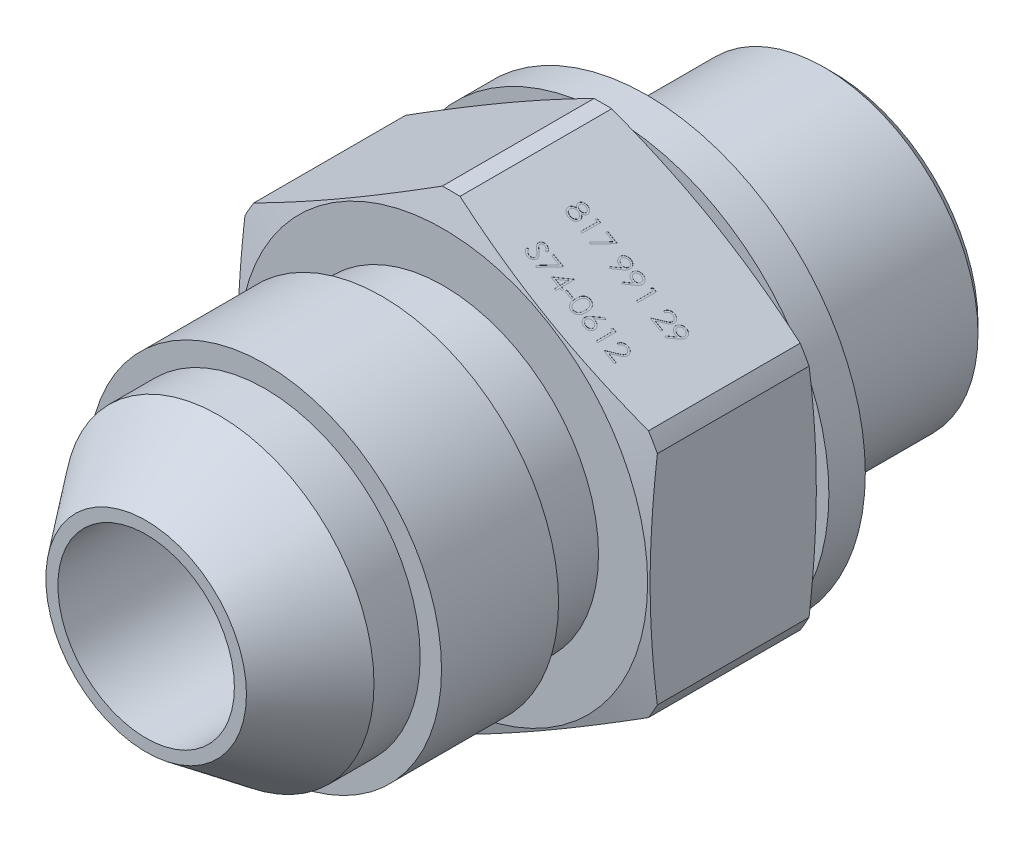
from build123d import *

# Parameters (mm, degrees)
SKETCH2_OUTSIDE_W  = 37.354
SKETCH2_OUTSIDE_H  = 37.354
EXTRUDE2_DEPTH     = 9
SKETCH3_R          = 11.75
SKETCH3_R_2        = 9.9
EXTRUDE3_DEPTH     = 1.96
SKETCH5_W          = 0.384615385
SKETCH5_H          = 0.102564102
CUT_EXTRUDE1_DEPTH = 0.01
SKETCH6_R          = 1.2


with BuildPart() as part:
    # Sketch1 → Revolve1 (revolve)
    with BuildSketch(Plane(origin=(0, 0, 0), x_dir=(0, 0, -1), z_dir=(1, 0, 0)), mode=Mode.PRIVATE) as revolve1_sk:
        Polygon((0, 5.4), (3.914782224, 8.35), (6.4, 8.35), (6.4, 9.5), (12.7, 9.5), (12.7, 8.35), (16, 8.35), (16, 10.99402544), (16.416922127, 12.55), (24.583077873, 12.55), (25, 10.99402544), (25, 8.275), (36.5, 8.275), (37, 7.775), (37, 6.8), (33.449295844, 4.75), (0, 4.75), align=None)
    revolve(revolve1_sk.sketch.rotate(Axis((0, 0, 0), (0, 0, -1)), 90), axis=Axis((0, 0, 0), (0, 0, -1)))

    # Sketch2 outside → Extrude2 (cut)
    with BuildSketch(Plane.XY.offset(-16)):
        Rectangle(SKETCH2_OUTSIDE_W, SKETCH2_OUTSIDE_H)
        Polygon((0, 12.817175976), (-11.1, 6.408587988), (-11.1, -6.408587988), (0, -12.817175976), (11.1, -6.408587988), (11.1, 6.408587988), align=None, mode=Mode.SUBTRACT)
    extrude(amount=-EXTRUDE2_DEPTH, mode=Mode.SUBTRACT)

    # Sketch3 → Extrude3 (add)
    with BuildSketch(Plane(origin=(0, 0, -25), x_dir=(-1, 0, 0), z_dir=(0, 0, -1))):
        Circle(SKETCH3_R)
        Circle(SKETCH3_R_2, mode=Mode.SUBTRACT)
    extrude(amount=EXTRUDE3_DEPTH)

    # Sketch5 → Cut-Extrude1 (cut)
    # profile 1 of 16: a face of its own
    with BuildSketch(Plane(origin=(5.55, 9.612881982, 0), x_dir=(0.8660254037844386, -0.5000000000000001, 0), z_dir=(0.5000000000000001, 0.8660254037844386, 0))):
        with BuildLine():
            add(Edge.make_bspline(
                [(-2.871822735, 20.366585469), (-2.863637436, 20.362317482), (-2.847673369, 20.353993481), (-2.824937024, 20.340590387), (-2.804158452, 20.326464397), (-2.784761149, 20.312282723), (-2.767085906, 20.297502251), (-2.751330359, 20.282064207), (-2.737105325, 20.266353937), (-2.724697672, 20.250105411), (-2.71378429, 20.233361797), (-2.704352252, 20.216079147), (-2.696290194, 20.198295338), (-2.689900783, 20.179816243), (-2.684637414, 20.160913311), (-2.681015812, 20.14134246), (-2.679068121, 20.121232648), (-2.678699889, 20.107641705), (-2.67851344, 20.100760149)],
                knots=[0, 0, 0, 0, 1.272397273, 2.481599622, 3.635517121, 4.734568067, 5.792894095, 6.808321871, 7.773003508, 8.711915296, 9.623354172, 10.525449501, 11.423591555, 12.311487226, 13.218079475, 14.126165749, 15.051214107, 16, 16, 16, 16], degree=3))
            add(Edge.make_bspline(
                [(-2.67851344, 20.100760149), (-2.678733846, 20.091132225), (-2.679170112, 20.072074952), (-2.682970108, 20.043947491), (-2.68865953, 20.016629839), (-2.696967962, 19.990127985), (-2.707743217, 19.964588164), (-2.721022313, 19.939988514), (-2.736054085, 19.915925854), (-2.748126154, 19.901120311), (-2.754234594, 19.893628738)],
                knots=[0, 0, 0, 0, 1.025265484, 2.029385089, 3.018602448, 3.995076438, 4.983346944, 5.966715145, 6.97116228, 8, 8, 8, 8], degree=3))
            add(Edge.make_bspline(
                [(-2.754234594, 19.893628738), (-2.762187873, 19.88488766), (-2.777996148, 19.867513519), (-2.805076985, 19.844956145), (-2.834797523, 19.825999175), (-2.867042761, 19.810550062), (-2.901726504, 19.798525531), (-2.938841363, 19.789884812), (-2.978459692, 19.784935546), (-3.005689827, 19.784220121), (-3.019659274, 19.783853097)],
                knots=[0, 0, 0, 0, 0.954267603, 1.896743057, 2.838368354, 3.796610408, 4.779680527, 5.799409237, 6.871065594, 8, 8, 8, 8], degree=3))
            add(Edge.make_bspline(
                [(-3.019659274, 19.783853097), (-3.03309167, 19.784182377), (-3.05922975, 19.784823121), (-3.097274858, 19.789164387), (-3.132738592, 19.796772349), (-3.165827155, 19.807185095), (-3.196341067, 19.820730874), (-3.224193382, 19.837590419), (-3.249785945, 19.857085117), (-3.27234208, 19.879774854), (-3.29236735, 19.904077103), (-3.309958222, 19.929148992), (-3.324579388, 19.954992808), (-3.336958558, 19.981223199), (-3.346435136, 20.008207814), (-3.352998624, 20.035807818), (-3.357167, 20.063975001), (-3.35772161, 20.082984045), (-3.35800062, 20.092547007)],
                knots=[0, 0, 0, 0, 1.256902934, 2.445805442, 3.576955095, 4.645999104, 5.686449165, 6.692658513, 7.68621702, 8.689161843, 9.678783111, 10.630372946, 11.551080876, 12.453998257, 13.34127905, 14.221779781, 15.105423033, 16, 16, 16, 16], degree=3))
            add(Edge.make_bspline(
                [(-3.35800062, 20.092547007), (-3.357835511, 20.09956392), (-3.357509198, 20.113431814), (-3.355250669, 20.133920194), (-3.351619681, 20.153861947), (-3.346688407, 20.173330731), (-3.340005257, 20.192184808), (-3.331936076, 20.210513515), (-3.322526947, 20.228337543), (-3.311646614, 20.245754367), (-3.298988893, 20.262519942), (-3.284656421, 20.278918797), (-3.268362744, 20.294696473), (-3.250289128, 20.310045738), (-3.230642116, 20.325238873), (-3.208911393, 20.339454796), (-3.185673031, 20.353699928), (-3.169157201, 20.362216593), (-3.160684915, 20.366585469)],
                knots=[0, 0, 0, 0, 0.941657376, 1.861047343, 2.762797495, 3.66048619, 4.553285746, 5.444104102, 6.34607688, 7.256116206, 8.197091036, 9.162375105, 10.176350973, 11.237807142, 12.343728897, 13.50695164, 14.721116704, 16, 16, 16, 16], degree=3))
            add(Edge.make_bspline(
                [(-3.160684915, 20.366585469), (-3.17228245, 20.372909689), (-3.194738525, 20.385155148), (-3.224472651, 20.407654235), (-3.25001283, 20.432022182), (-3.270657035, 20.458773552), (-3.286906243, 20.487072659), (-3.298054415, 20.516742446), (-3.305596268, 20.547232764), (-3.306343361, 20.568063106), (-3.306718569, 20.578524572)],
                knots=[0, 0, 0, 0, 1.166880483, 2.259407225, 3.286803203, 4.280235371, 5.237608625, 6.161067461, 7.076446754, 8, 8, 8, 8], degree=3))
            add(Edge.make_bspline(
                [(-3.306718569, 20.578524572), (-3.306251304, 20.589181017), (-3.305312022, 20.61060233), (-3.297716788, 20.642489794), (-3.285339626, 20.673808813), (-3.268505055, 20.704407588), (-3.247537279, 20.733250506), (-3.222381123, 20.759119348), (-3.193637324, 20.781779772), (-3.161449362, 20.800801535), (-3.126810438, 20.816282581), (-3.090263088, 20.82696213), (-3.05244409, 20.833943878), (-3.026701885, 20.83473435), (-3.013649658, 20.835135149)],
                knots=[0, 0, 0, 0, 0.888701115, 1.786444228, 2.72001202, 3.692817113, 4.693886446, 5.687152267, 6.695133018, 7.739871481, 8.800368666, 9.853104506, 10.91144658, 12, 12, 12, 12], degree=3))
            add(Edge.make_bspline(
                [(-3.013649658, 20.835135149), (-3.000934283, 20.834721908), (-2.97586101, 20.833907044), (-2.939005402, 20.827110793), (-2.903741152, 20.815759501), (-2.870189866, 20.800360295), (-2.83895219, 20.781392597), (-2.81135153, 20.758420919), (-2.786970792, 20.73266619), (-2.766803823, 20.703832018), (-2.750185854, 20.67335082), (-2.738614168, 20.641458671), (-2.731199318, 20.608844654), (-2.730264071, 20.586776653), (-2.729795492, 20.575720084)],
                knots=[0, 0, 0, 0, 1.072916533, 2.115669174, 3.151510826, 4.193348718, 5.225979165, 6.227137561, 7.216255879, 8.211077061, 9.189680878, 10.138522389, 11.067357538, 12, 12, 12, 12], degree=3))
            add(Edge.make_bspline(
                [(-2.729795492, 20.575720084), (-2.730205366, 20.564869609), (-2.731010336, 20.543559892), (-2.737781748, 20.512495172), (-2.749185551, 20.483403161), (-2.764755312, 20.455953746), (-2.785048309, 20.430644747), (-2.809793661, 20.407154327), (-2.838794083, 20.385289519), (-2.860582908, 20.372950557), (-2.871822735, 20.366585469)],
                knots=[0, 0, 0, 0, 0.975232327, 1.915300861, 2.843280834, 3.77672583, 4.742871857, 5.749627742, 6.839139064, 8, 8, 8, 8], degree=3))
        make_face()
        with BuildLine():
            add(Edge.make_bspline(
                [(-3.018657671, 20.732571046), (-3.025672187, 20.73238492), (-3.039395647, 20.732020776), (-3.059518125, 20.730118309), (-3.078653087, 20.72641739), (-3.097000459, 20.721492044), (-3.114308691, 20.714838333), (-3.130812849, 20.707011187), (-3.146232046, 20.697495168), (-3.160752418, 20.68682054), (-3.173824068, 20.67507971), (-3.185425369, 20.662847219), (-3.195061973, 20.649882821), (-3.203245147, 20.636509004), (-3.209182723, 20.62232884), (-3.213629667, 20.607777075), (-3.216635779, 20.592669822), (-3.216861033, 20.582345105), (-3.216974979, 20.577122328)],
                knots=[0, 0, 0, 0, 1.203892937, 2.355340988, 3.463153438, 4.544400666, 5.610487187, 6.640501085, 7.674077295, 8.714426146, 9.728707835, 10.68524104, 11.601827946, 12.495867327, 13.368432065, 14.231010473, 15.105153427, 16, 16, 16, 16], degree=3))
            add(Edge.make_bspline(
                [(-3.216974979, 20.577122328), (-3.216778588, 20.571899325), (-3.216390492, 20.561577922), (-3.213389027, 20.546336246), (-3.20891564, 20.531358635), (-3.201872594, 20.517001232), (-3.193425063, 20.502765986), (-3.182998927, 20.489008676), (-3.17057349, 20.475681423), (-3.15656565, 20.462897583), (-3.141305211, 20.450926508), (-3.125138341, 20.44053417), (-3.108267944, 20.43183871), (-3.090867353, 20.424601737), (-3.072759225, 20.418976041), (-3.054054518, 20.414984999), (-3.034750089, 20.412504429), (-3.021669923, 20.412208137), (-3.015051902, 20.412058225)],
                knots=[0, 0, 0, 0, 0.873023192, 1.725219244, 2.590779336, 3.480155217, 4.391973325, 5.357036234, 6.360879153, 7.436073238, 8.526419356, 9.601555421, 10.645666583, 11.697338044, 12.750135903, 13.812665442, 14.89329948, 16, 16, 16, 16], degree=3))
            add(Edge.make_bspline(
                [(-3.015051902, 20.412058225), (-3.006551872, 20.412307616), (-2.989635767, 20.412803934), (-2.964698815, 20.417418555), (-2.940452345, 20.424677389), (-2.917155516, 20.434608808), (-2.895411348, 20.447073911), (-2.876028472, 20.46199763), (-2.859172217, 20.479035372), (-2.845017757, 20.497921897), (-2.834043515, 20.51802235), (-2.825500141, 20.538193863), (-2.820511222, 20.558651643), (-2.819860489, 20.57235649), (-2.819539081, 20.579125533)],
                knots=[0, 0, 0, 0, 1.076279235, 2.141928126, 3.20205304, 4.278698113, 5.344010996, 6.36967002, 7.368914609, 8.37248503, 9.349703398, 10.264243087, 11.142681841, 12, 12, 12, 12], degree=3))
            add(Edge.make_bspline(
                [(-2.819539081, 20.579125533), (-2.819691052, 20.583876401), (-2.819992692, 20.593306191), (-2.822478422, 20.607231439), (-2.826585803, 20.620839891), (-2.832146683, 20.634243968), (-2.839463768, 20.647255606), (-2.84813925, 20.660079346), (-2.858677679, 20.672426707), (-2.870505231, 20.684585435), (-2.883918205, 20.695838013), (-2.898890751, 20.705733644), (-2.915346109, 20.714137175), (-2.933284666, 20.720962533), (-2.952640358, 20.726088919), (-2.973324037, 20.729927876), (-2.995508164, 20.732091622), (-3.010773808, 20.732407772), (-3.018657671, 20.732571046)],
                knots=[0, 0, 0, 0, 0.814439003, 1.616544685, 2.417341072, 3.248991801, 4.09997495, 4.973547432, 5.9003056, 6.880240646, 7.880314356, 8.896779544, 9.951930927, 11.043077905, 12.18215768, 13.381699519, 14.647792085, 16, 16, 16, 16], degree=3))
        make_face(mode=Mode.SUBTRACT)
        with BuildLine():
            add(Edge.make_bspline(
                [(-3.012848376, 20.309494123), (-3.021741458, 20.30933594), (-3.039187514, 20.309025623), (-3.064746636, 20.30557148), (-3.089276112, 20.300763082), (-3.112693237, 20.293468556), (-3.134988122, 20.283983845), (-3.156281459, 20.272573976), (-3.176410354, 20.259086707), (-3.195096847, 20.243693388), (-3.212160655, 20.227104973), (-3.227131598, 20.209544363), (-3.239845175, 20.191337925), (-3.250083247, 20.172254431), (-3.258486599, 20.15269797), (-3.26400485, 20.132181515), (-3.267542482, 20.111099482), (-3.268017519, 20.096768026), (-3.26825703, 20.0895422)],
                knots=[0, 0, 0, 0, 1.140299081, 2.23698856, 3.303958914, 4.344563908, 5.37730929, 6.408454204, 7.439741482, 8.480804886, 9.510774543, 10.48932336, 11.43758569, 12.353841022, 13.263987381, 14.161954604, 15.073269652, 16, 16, 16, 16], degree=3))
            add(Edge.make_bspline(
                [(-3.26825703, 20.0895422), (-3.267867528, 20.080561941), (-3.267094764, 20.062745317), (-3.260964295, 20.036413011), (-3.251125571, 20.010921281), (-3.237404081, 19.986477866), (-3.220413346, 19.963634978), (-3.199520069, 19.9437239), (-3.176022687, 19.926032049), (-3.149126157, 19.911723325), (-3.119746595, 19.900296223), (-3.087891816, 19.892423091), (-3.054018982, 19.887211248), (-3.030630527, 19.886686054), (-3.018657671, 19.8864172)],
                knots=[0, 0, 0, 0, 0.898778495, 1.783155532, 2.693654817, 3.627872908, 4.583023416, 5.533784346, 6.509005473, 7.520592997, 8.575161974, 9.658835044, 10.801527049, 12, 12, 12, 12], degree=3))
            add(Edge.make_bspline(
                [(-3.018657671, 19.8864172), (-3.009300423, 19.886596859), (-2.991069503, 19.886946894), (-2.964473518, 19.890036692), (-2.939375076, 19.894936585), (-2.915822847, 19.902063312), (-2.893553179, 19.910763306), (-2.872943649, 19.921955329), (-2.85346407, 19.934684564), (-2.836074321, 19.949786894), (-2.820236261, 19.965923893), (-2.806426749, 19.983006762), (-2.794438877, 20.000571229), (-2.785030033, 20.019014224), (-2.777508246, 20.037981914), (-2.772101516, 20.057649203), (-2.768765454, 20.078076413), (-2.768428056, 20.09193329), (-2.76825703, 20.098957264)],
                knots=[0, 0, 0, 0, 1.224942928, 2.386581632, 3.501229538, 4.569074225, 5.605009692, 6.626002462, 7.634866581, 8.645888296, 9.63523824, 10.59253846, 11.518950513, 12.414518923, 13.29783783, 14.186679152, 15.080837789, 16, 16, 16, 16], degree=3))
            add(Edge.make_bspline(
                [(-2.76825703, 20.098957264), (-2.768515844, 20.105779361), (-2.76902618, 20.119231345), (-2.772265234, 20.139164639), (-2.777955485, 20.158422586), (-2.785763313, 20.177236873), (-2.796157873, 20.195226288), (-2.808399265, 20.212859479), (-2.823169013, 20.229647035), (-2.839858326, 20.245719348), (-2.858046601, 20.260580987), (-2.877380071, 20.27372797), (-2.897709917, 20.284800003), (-2.91899312, 20.293804716), (-2.941182422, 20.30088685), (-2.964261501, 20.305834277), (-2.98825738, 20.308948449), (-3.004558771, 20.309310177), (-3.012848376, 20.309494123)],
                knots=[0, 0, 0, 0, 0.917430815, 1.809013306, 2.70690318, 3.612392954, 4.541220862, 5.495268465, 6.494511384, 7.542276156, 8.608045339, 9.649016899, 10.681629292, 11.715607085, 12.752076957, 13.808767841, 14.885711793, 16, 16, 16, 16], degree=3))
        make_face(mode=Mode.SUBTRACT)
    # profile 2 of 16: a face of its own
    with BuildSketch(Plane(origin=(5.55, 9.612881982, 0), x_dir=(0.8660254037844386, -0.5000000000000001, 0), z_dir=(0.5000000000000001, 0.8660254037844386, 0))):
        Polygon((-2.376229786, 20.809494123), (-2.191333953, 20.809494123), (-2.191333953, 19.809494123), (-2.281077543, 19.809494123), (-2.281077543, 20.70693002), (-2.434923697, 20.70693002), align=None)
    # profile 3 of 16: a face of its own
    with BuildSketch(Plane(origin=(5.55, 9.612881982, 0), x_dir=(0.8660254037844386, -0.5000000000000001, 0), z_dir=(0.5000000000000001, 0.8660254037844386, 0))):
        Polygon((-1.755436517, 20.809494123), (-1.140051902, 20.809494123), (-1.665692927, 19.783853097), (-1.743216966, 19.826521366), (-1.292095171, 20.70693002), (-1.755436517, 20.70693002), align=None)
    # profile 4 of 16: a face of its own
    with BuildSketch(Plane(origin=(5.55, 9.612881982, 0), x_dir=(0.8660254037844386, -0.5000000000000001, 0), z_dir=(0.5000000000000001, 0.8660254037844386, 0))):
        with BuildLine():
            Line((-0.44774421, 19.783853097), (-0.519458953, 19.833732905))
            Line((-0.519458953, 19.833732905), (-0.241414081, 20.240183225))
            add(Edge.make_bspline(
                [(-0.241414081, 20.240183225), (-0.259154292, 20.238013779), (-0.294085754, 20.233742017), (-0.329267784, 20.232957259), (-0.346582351, 20.232571046)],
                knots=[0, 0, 0, 0, 1.015715272, 2, 2, 2, 2], degree=3))
            add(Edge.make_bspline(
                [(-0.346582351, 20.232571046), (-0.357080079, 20.232839925), (-0.3776862, 20.233367711), (-0.407980958, 20.237551085), (-0.437091118, 20.243993978), (-0.464939506, 20.253607908), (-0.491630793, 20.265555968), (-0.517106711, 20.280372258), (-0.541332966, 20.297802627), (-0.564049368, 20.31775491), (-0.584709865, 20.339662925), (-0.603116522, 20.362850252), (-0.618413988, 20.387586243), (-0.631121584, 20.413366306), (-0.640758856, 20.440560978), (-0.647776724, 20.468860806), (-0.652097397, 20.498464132), (-0.652611424, 20.51861417), (-0.652872415, 20.528845084)],
                knots=[0, 0, 0, 0, 1.060718605, 2.082097864, 3.085795603, 4.069760067, 5.054557537, 6.03741023, 7.043284206, 8.066802108, 9.088538119, 10.083643548, 11.053783639, 12.022749082, 12.983451788, 13.964007469, 14.966251758, 16, 16, 16, 16], degree=3))
            add(Edge.make_bspline(
                [(-0.652872415, 20.528845084), (-0.652376862, 20.542836128), (-0.651404192, 20.570297708), (-0.643576044, 20.610421642), (-0.630701662, 20.648360655), (-0.612750697, 20.684014996), (-0.590140777, 20.716871779), (-0.562966894, 20.746474238), (-0.531394333, 20.77240134), (-0.496142327, 20.794688219), (-0.458041464, 20.812612504), (-0.418136133, 20.825823732), (-0.376732099, 20.833594803), (-0.348684193, 20.834619335), (-0.33456312, 20.835135149)],
                knots=[0, 0, 0, 0, 1.022988612, 2.007919123, 2.978103895, 3.94594894, 4.918897164, 5.887013414, 6.875921846, 7.89917871, 8.930658928, 9.948724884, 10.967259574, 12, 12, 12, 12], degree=3))
            add(Edge.make_bspline(
                [(-0.33456312, 20.835135149), (-0.320709286, 20.834612245), (-0.293335415, 20.833579036), (-0.253081413, 20.826012188), (-0.214526837, 20.813258853), (-0.177885412, 20.795634692), (-0.143959866, 20.773543004), (-0.113452491, 20.747218854), (-0.08705948, 20.716645847), (-0.064824086, 20.682563421), (-0.046975503, 20.645944283), (-0.034097707, 20.607720305), (-0.026170382, 20.568166385), (-0.025171431, 20.541367964), (-0.024667286, 20.527843482)],
                knots=[0, 0, 0, 0, 1.026385292, 2.028040595, 3.023318987, 4.028184125, 5.03290303, 6.015178782, 7.004435299, 8.016004309, 9.023023918, 10.015172535, 10.998308025, 12, 12, 12, 12], degree=3))
            add(Edge.make_bspline(
                [(-0.024667286, 20.527843482), (-0.025003975, 20.517345263), (-0.025686863, 20.496052251), (-0.030468665, 20.463700725), (-0.038588718, 20.430714659), (-0.047803489, 20.402794203), (-0.056698394, 20.379734646), (-0.065070146, 20.361519909), (-0.074359332, 20.342348119), (-0.085193265, 20.322420308), (-0.096839636, 20.301482441), (-0.109999429, 20.279744523), (-0.12437245, 20.257177382), (-0.134609512, 20.241963928), (-0.139851581, 20.23417361)],
                knots=[0, 0, 0, 0, 1.179839688, 2.393009684, 3.667231171, 4.993948276, 5.694988576, 6.444077775, 7.246288328, 8.089075292, 8.993003841, 9.939041771, 10.944649915, 12, 12, 12, 12], degree=3))
            Line((-0.139851581, 20.23417361), (-0.44774421, 19.783853097))
        make_face()
        with BuildLine():
            add(Edge.make_bspline(
                [(-0.329955748, 20.335135149), (-0.322003173, 20.335352401), (-0.306522212, 20.335775318), (-0.283842983, 20.338349387), (-0.262436068, 20.342913383), (-0.242244283, 20.349461872), (-0.223065168, 20.357363777), (-0.20520336, 20.367424345), (-0.18864391, 20.379429098), (-0.17327593, 20.392917674), (-0.159629073, 20.407903555), (-0.147473922, 20.423588442), (-0.137142331, 20.440041188), (-0.128981395, 20.457467834), (-0.122271516, 20.47544418), (-0.117637798, 20.49425971), (-0.115070846, 20.513816396), (-0.114633253, 20.527101726), (-0.114410876, 20.533853097)],
                knots=[0, 0, 0, 0, 1.163407946, 2.26475976, 3.333800367, 4.359385343, 5.366239384, 6.363380779, 7.350133999, 8.353570782, 9.349036268, 10.310270964, 11.253520213, 12.184142, 13.120487599, 14.056272588, 15.012232024, 16, 16, 16, 16], degree=3))
            add(Edge.make_bspline(
                [(-0.114410876, 20.533853097), (-0.11460221, 20.540607287), (-0.114979257, 20.553917247), (-0.1180042, 20.573502887), (-0.123325693, 20.59227239), (-0.130465831, 20.610328513), (-0.139871613, 20.627522905), (-0.151158324, 20.64407144), (-0.164567595, 20.659869191), (-0.179996899, 20.674544615), (-0.196635343, 20.688072586), (-0.214366915, 20.700011465), (-0.233045462, 20.710017521), (-0.252557031, 20.718274369), (-0.272942273, 20.724717734), (-0.294189127, 20.729351267), (-0.316404957, 20.731914625), (-0.331485325, 20.732349452), (-0.339170492, 20.732571046)],
                knots=[0, 0, 0, 0, 0.972161553, 1.915763587, 2.844109794, 3.775983486, 4.705125789, 5.659731448, 6.655561913, 7.682237399, 8.721216875, 9.739758359, 10.754845918, 11.767244016, 12.7857855, 13.828538656, 14.893392813, 16, 16, 16, 16], degree=3))
            add(Edge.make_bspline(
                [(-0.339170492, 20.732571046), (-0.346788821, 20.732349094), (-0.361735921, 20.731913626), (-0.383754252, 20.729356139), (-0.404857443, 20.724686572), (-0.42518362, 20.718277354), (-0.444694609, 20.710016905), (-0.463372275, 20.70001094), (-0.481107995, 20.688075334), (-0.497730486, 20.67453397), (-0.513187035, 20.6599375), (-0.526365758, 20.644002235), (-0.537678299, 20.627531513), (-0.547071156, 20.610326225), (-0.554214733, 20.592273001), (-0.559535305, 20.573502722), (-0.562560495, 20.55391729), (-0.562937508, 20.540607302), (-0.563128825, 20.533853097)],
                knots=[0, 0, 0, 0, 1.099389452, 2.15699305, 3.192601482, 4.213358962, 5.227959689, 6.245255729, 7.266013209, 8.307253147, 9.336162325, 10.327954924, 11.284637477, 12.215801273, 13.149702402, 14.080068371, 15.025723358, 16, 16, 16, 16], degree=3))
            add(Edge.make_bspline(
                [(-0.563128825, 20.533853097), (-0.562955703, 20.527096469), (-0.562614275, 20.513771162), (-0.559320621, 20.494192192), (-0.553812541, 20.475424137), (-0.546435573, 20.457284506), (-0.536720832, 20.43994969), (-0.524799733, 20.423501872), (-0.51082672, 20.4077546), (-0.494988581, 20.39295254), (-0.47765482, 20.379366204), (-0.459141464, 20.367500381), (-0.439767225, 20.357479682), (-0.419463902, 20.349439287), (-0.398381959, 20.342978811), (-0.376331922, 20.338357798), (-0.353386711, 20.335800008), (-0.337841002, 20.335358895), (-0.329955748, 20.335135149)],
                knots=[0, 0, 0, 0, 0.952633368, 1.87876736, 2.791047057, 3.707742249, 4.635551637, 5.587206343, 6.568248508, 7.601284464, 8.641511608, 9.671105535, 10.699146789, 11.713763218, 12.747829548, 13.806491675, 14.887386225, 16, 16, 16, 16], degree=3))
        make_face(mode=Mode.SUBTRACT)
    # profile 5 of 16: a face of its own
    with BuildSketch(Plane(origin=(5.55, 9.612881982, 0), x_dir=(0.8660254037844386, -0.5000000000000001, 0), z_dir=(0.5000000000000001, 0.8660254037844386, 0))):
        with BuildLine():
            Line((0.32148656, 19.783853097), (0.249771816, 19.833732905))
            Line((0.249771816, 19.833732905), (0.527816688, 20.240183225))
            add(Edge.make_bspline(
                [(0.527816688, 20.240183225), (0.510076478, 20.238013779), (0.475145015, 20.233742017), (0.439962986, 20.232957259), (0.422648419, 20.232571046)],
                knots=[0, 0, 0, 0, 1.015715272, 2, 2, 2, 2], degree=3))
            add(Edge.make_bspline(
                [(0.422648419, 20.232571046), (0.412150691, 20.232839925), (0.391544569, 20.233367711), (0.361249811, 20.237551085), (0.332139651, 20.243993978), (0.304291263, 20.253607908), (0.277599976, 20.265555968), (0.252124058, 20.280372258), (0.227897804, 20.297802627), (0.205181401, 20.31775491), (0.184520904, 20.339662925), (0.166114248, 20.362850252), (0.150816781, 20.387586243), (0.138109185, 20.413366306), (0.128471913, 20.440560978), (0.121454045, 20.468860806), (0.117133372, 20.498464132), (0.116619345, 20.51861417), (0.116358355, 20.528845084)],
                knots=[0, 0, 0, 0, 1.060718605, 2.082097864, 3.085795603, 4.069760067, 5.054557537, 6.03741023, 7.043284206, 8.066802108, 9.088538119, 10.083643548, 11.053783639, 12.022749082, 12.983451788, 13.964007469, 14.966251758, 16, 16, 16, 16], degree=3))
            add(Edge.make_bspline(
                [(0.116358355, 20.528845084), (0.116853907, 20.542836128), (0.117826577, 20.570297708), (0.125654725, 20.610421642), (0.138529107, 20.648360655), (0.156480072, 20.684014996), (0.179089993, 20.716871779), (0.206263875, 20.746474238), (0.237836437, 20.77240134), (0.273088442, 20.794688219), (0.311189305, 20.812612504), (0.351094636, 20.825823732), (0.39249867, 20.833594803), (0.420546576, 20.834619335), (0.434667649, 20.835135149)],
                knots=[0, 0, 0, 0, 1.022988612, 2.007919123, 2.978103895, 3.94594894, 4.918897164, 5.887013414, 6.875921846, 7.89917871, 8.930658928, 9.948724884, 10.967259574, 12, 12, 12, 12], degree=3))
            add(Edge.make_bspline(
                [(0.434667649, 20.835135149), (0.448521484, 20.834612245), (0.475895354, 20.833579036), (0.516149356, 20.826012188), (0.554703932, 20.813258853), (0.591345357, 20.795634692), (0.625270903, 20.773543004), (0.655778278, 20.747218854), (0.682171289, 20.716645847), (0.704406684, 20.682563421), (0.722255267, 20.645944283), (0.735133062, 20.607720305), (0.743060387, 20.568166385), (0.744059338, 20.541367964), (0.744563483, 20.527843482)],
                knots=[0, 0, 0, 0, 1.026385292, 2.028040595, 3.023318987, 4.028184125, 5.03290303, 6.015178782, 7.004435299, 8.016004309, 9.023023918, 10.015172535, 10.998308025, 12, 12, 12, 12], degree=3))
            add(Edge.make_bspline(
                [(0.744563483, 20.527843482), (0.744226795, 20.517345263), (0.743543907, 20.496052251), (0.738762105, 20.463700725), (0.730642052, 20.430714659), (0.721427281, 20.402794203), (0.712532376, 20.379734646), (0.704160624, 20.361519909), (0.694871437, 20.342348119), (0.684037504, 20.322420308), (0.672391133, 20.301482441), (0.65923134, 20.279744523), (0.64485832, 20.257177382), (0.634621257, 20.241963928), (0.629379188, 20.23417361)],
                knots=[0, 0, 0, 0, 1.179839688, 2.393009684, 3.667231171, 4.993948276, 5.694988576, 6.444077775, 7.246288328, 8.089075292, 8.993003841, 9.939041771, 10.944649915, 12, 12, 12, 12], degree=3))
            Line((0.629379188, 20.23417361), (0.32148656, 19.783853097))
        make_face()
        with BuildLine():
            add(Edge.make_bspline(
                [(0.439275021, 20.335135149), (0.447227597, 20.335352401), (0.462708558, 20.335775318), (0.485387786, 20.338349387), (0.506794701, 20.342913383), (0.526986487, 20.349461872), (0.546165601, 20.357363777), (0.56402741, 20.367424345), (0.58058686, 20.379429098), (0.595954839, 20.392917674), (0.609601696, 20.407903555), (0.621756847, 20.423588442), (0.632088438, 20.440041188), (0.640249374, 20.457467834), (0.646959253, 20.47544418), (0.651592971, 20.49425971), (0.654159923, 20.513816396), (0.654597516, 20.527101726), (0.654819893, 20.533853097)],
                knots=[0, 0, 0, 0, 1.163407946, 2.26475976, 3.333800367, 4.359385343, 5.366239384, 6.363380779, 7.350133999, 8.353570782, 9.349036268, 10.310270964, 11.253520213, 12.184142, 13.120487599, 14.056272588, 15.012232024, 16, 16, 16, 16], degree=3))
            add(Edge.make_bspline(
                [(0.654819893, 20.533853097), (0.654628559, 20.540607287), (0.654251512, 20.553917247), (0.651226569, 20.573502887), (0.645905077, 20.59227239), (0.638764938, 20.610328513), (0.629359156, 20.627522905), (0.618072446, 20.64407144), (0.604663174, 20.659869191), (0.58923387, 20.674544615), (0.572595426, 20.688072586), (0.554863855, 20.700011465), (0.536185307, 20.710017521), (0.516673739, 20.718274369), (0.496288496, 20.724717734), (0.475041642, 20.729351267), (0.452825812, 20.731914625), (0.437745445, 20.732349452), (0.430060278, 20.732571046)],
                knots=[0, 0, 0, 0, 0.972161553, 1.915763587, 2.844109794, 3.775983486, 4.705125789, 5.659731448, 6.655561913, 7.682237399, 8.721216875, 9.739758359, 10.754845918, 11.767244016, 12.7857855, 13.828538656, 14.893392813, 16, 16, 16, 16], degree=3))
            add(Edge.make_bspline(
                [(0.430060278, 20.732571046), (0.422441948, 20.732349094), (0.407494848, 20.731913626), (0.385476517, 20.729356139), (0.364373326, 20.724686572), (0.344047149, 20.718277354), (0.32453616, 20.710016905), (0.305858494, 20.70001094), (0.288122775, 20.688075334), (0.271500283, 20.67453397), (0.256043734, 20.6599375), (0.242865011, 20.644002235), (0.231552471, 20.627531513), (0.222159613, 20.610326225), (0.215016036, 20.592273001), (0.209695465, 20.573502722), (0.206670274, 20.55391729), (0.206293261, 20.540607302), (0.206101944, 20.533853097)],
                knots=[0, 0, 0, 0, 1.099389452, 2.15699305, 3.192601482, 4.213358962, 5.227959689, 6.245255729, 7.266013209, 8.307253147, 9.336162325, 10.327954924, 11.284637477, 12.215801273, 13.149702402, 14.080068371, 15.025723358, 16, 16, 16, 16], degree=3))
            add(Edge.make_bspline(
                [(0.206101944, 20.533853097), (0.206275066, 20.527096469), (0.206616494, 20.513771162), (0.209910148, 20.494192192), (0.215418228, 20.475424137), (0.222795197, 20.457284506), (0.232509937, 20.43994969), (0.244431036, 20.423501872), (0.258404049, 20.4077546), (0.274242189, 20.39295254), (0.291575949, 20.379366204), (0.310089305, 20.367500381), (0.329463544, 20.357479682), (0.349766867, 20.349439287), (0.37084881, 20.342978811), (0.392898848, 20.338357798), (0.415844058, 20.335800008), (0.431389767, 20.335358895), (0.439275021, 20.335135149)],
                knots=[0, 0, 0, 0, 0.952633368, 1.87876736, 2.791047057, 3.707742249, 4.635551637, 5.587206343, 6.568248508, 7.601284464, 8.641511608, 9.671105535, 10.699146789, 11.713763218, 12.747829548, 13.806491675, 14.887386225, 16, 16, 16, 16], degree=3))
        make_face(mode=Mode.SUBTRACT)
    # profile 6 of 16: a face of its own
    with BuildSketch(Plane(origin=(5.55, 9.612881982, 0), x_dir=(0.8660254037844386, -0.5000000000000001, 0), z_dir=(0.5000000000000001, 0.8660254037844386, 0))):
        Polygon((1.085308675, 20.809494123), (1.270204508, 20.809494123), (1.270204508, 19.809494123), (1.180460919, 19.809494123), (1.180460919, 20.70693002), (1.026614765, 20.70693002), align=None)
    # profile 7 of 16: a face of its own
    with BuildSketch(Plane(origin=(5.55, 9.612881982, 0), x_dir=(0.8660254037844386, -0.5000000000000001, 0), z_dir=(0.5000000000000001, 0.8660254037844386, 0))):
        with BuildLine():
            Line((2.154819893, 20.501801815), (2.065076303, 20.501801815))
            add(Edge.make_bspline(
                [(2.065076303, 20.501801815), (2.065661204, 20.513707783), (2.066809934, 20.537090787), (2.072189445, 20.571183332), (2.079886839, 20.603770417), (2.090770111, 20.634590393), (2.104286191, 20.663915766), (2.12049477, 20.691630056), (2.139693013, 20.717627539), (2.161466365, 20.741667208), (2.185114548, 20.7637208), (2.210630531, 20.782765155), (2.237443396, 20.798855918), (2.265471795, 20.812307702), (2.295031956, 20.822404801), (2.32585563, 20.829896698), (2.35807824, 20.834404225), (2.380032532, 20.834888735), (2.391198098, 20.835135149)],
                knots=[0, 0, 0, 0, 1.10065271, 2.161652631, 3.183658789, 4.190468796, 5.17591951, 6.163126047, 7.15150782, 8.156236427, 9.156009102, 10.134482811, 11.092018607, 12.041330605, 13.001268258, 13.972401359, 14.968799086, 16, 16, 16, 16], degree=3))
            add(Edge.make_bspline(
                [(2.391198098, 20.835135149), (2.402163262, 20.834878447), (2.423709418, 20.834374037), (2.455155708, 20.830042314), (2.485092077, 20.823257859), (2.513460011, 20.813739169), (2.540033172, 20.800943618), (2.565011185, 20.785572893), (2.588691416, 20.767795798), (2.61000764, 20.746866137), (2.629581377, 20.724522599), (2.646467736, 20.700668912), (2.66092864, 20.676031973), (2.672982263, 20.650423916), (2.681855445, 20.623603622), (2.688592076, 20.595961564), (2.692399908, 20.567211618), (2.692984315, 20.547752602), (2.693281431, 20.537859507)],
                knots=[0, 0, 0, 0, 1.111607364, 2.184268762, 3.212621178, 4.221274766, 5.211760367, 6.196651075, 7.1921475, 8.207485113, 9.220403448, 10.201281604, 11.166441695, 12.114753415, 13.065576456, 14.026450734, 14.996634279, 16, 16, 16, 16], degree=3))
            add(Edge.make_bspline(
                [(2.693281431, 20.537859507), (2.692799533, 20.523930991), (2.691844192, 20.496318382), (2.683599706, 20.455688566), (2.670861964, 20.416287121), (2.655412527, 20.38457882), (2.639806651, 20.35915685), (2.626040995, 20.338038096), (2.609568894, 20.315516263), (2.590541062, 20.291364517), (2.569244545, 20.265508983), (2.545526069, 20.23793905), (2.519204443, 20.208947534), (2.500730677, 20.189145873), (2.491158034, 20.178885149)],
                knots=[0, 0, 0, 0, 1.184203166, 2.347625244, 3.513805382, 4.700623107, 5.337941753, 6.051866363, 6.845199593, 7.711357327, 8.668078039, 9.695487809, 10.805859518, 12, 12, 12, 12], degree=3))
            Line((2.491158034, 20.178885149), (2.240957714, 19.912058225))
            Line((2.240957714, 19.912058225), (2.706101944, 19.912058225))
            Line((2.706101944, 19.912058225), (2.706101944, 19.809494123))
            Line((2.706101944, 19.809494123), (2.026614765, 19.809494123))
            Line((2.026614765, 19.809494123), (2.414435278, 20.223356302))
            add(Edge.make_bspline(
                [(2.414435278, 20.223356302), (2.423877531, 20.233212961), (2.442014167, 20.252145586), (2.467666332, 20.279786432), (2.490706043, 20.305429158), (2.511282441, 20.329025315), (2.528949157, 20.350920048), (2.544626937, 20.370404249), (2.557188535, 20.388334092), (2.570821505, 20.409117125), (2.5840255, 20.434492072), (2.595371887, 20.465501698), (2.602290415, 20.49742377), (2.603120368, 20.518995781), (2.603537842, 20.529846687)],
                knots=[0, 0, 0, 0, 1.329631726, 2.553950428, 3.673215718, 4.687767853, 5.603093632, 6.413772471, 7.123043292, 7.734684054, 8.834405432, 9.900288307, 10.943827018, 12, 12, 12, 12], degree=3))
            add(Edge.make_bspline(
                [(2.603537842, 20.529846687), (2.603356201, 20.536669944), (2.602998222, 20.550117272), (2.59983888, 20.569833203), (2.59506445, 20.588851722), (2.588222947, 20.607231327), (2.57919245, 20.624787228), (2.568200056, 20.641540794), (2.555517181, 20.657737641), (2.54084539, 20.672924297), (2.524727812, 20.686833213), (2.507700884, 20.69915438), (2.489686569, 20.709451269), (2.470760819, 20.717892268), (2.450976399, 20.724513806), (2.430295044, 20.729101971), (2.408773896, 20.731982681), (2.394078612, 20.732372445), (2.386590726, 20.732571046)],
                knots=[0, 0, 0, 0, 0.991446411, 1.95395049, 2.89581595, 3.838931463, 4.798493298, 5.75982156, 6.748411868, 7.785213223, 8.824556874, 9.840280684, 10.836137867, 11.835679398, 12.848801643, 13.863922112, 14.911575587, 16, 16, 16, 16], degree=3))
            add(Edge.make_bspline(
                [(2.386590726, 20.732571046), (2.378770488, 20.732366751), (2.363412832, 20.73196555), (2.340864537, 20.729159074), (2.319354315, 20.724317405), (2.298828057, 20.717695498), (2.279251033, 20.70927877), (2.260718449, 20.698795415), (2.243271909, 20.686285845), (2.226878616, 20.672102829), (2.211774622, 20.656312086), (2.198504086, 20.638709239), (2.186908654, 20.619615692), (2.17679173, 20.599082963), (2.168575819, 20.57692474), (2.162297776, 20.553219682), (2.157330105, 20.528070716), (2.155670528, 20.510703549), (2.154819893, 20.501801815)],
                knots=[0, 0, 0, 0, 1.031018746, 2.02475058, 2.990194455, 3.934040569, 4.864654155, 5.795059489, 6.735614925, 7.690564532, 8.649604399, 9.611025574, 10.590972636, 11.591080095, 12.624614302, 13.701020113, 14.821632451, 16, 16, 16, 16], degree=3))
        make_face()
    # profile 8 of 16: a face of its own
    with BuildSketch(Plane(origin=(5.55, 9.612881982, 0), x_dir=(0.8660254037844386, -0.5000000000000001, 0), z_dir=(0.5000000000000001, 0.8660254037844386, 0))):
        with BuildLine():
            Line((3.013794252, 19.783853097), (2.942079508, 19.833732905))
            Line((2.942079508, 19.833732905), (3.22012438, 20.240183225))
            add(Edge.make_bspline(
                [(3.22012438, 20.240183225), (3.20238417, 20.238013779), (3.167452707, 20.233742017), (3.132270678, 20.232957259), (3.114956111, 20.232571046)],
                knots=[0, 0, 0, 0, 1.015715272, 2, 2, 2, 2], degree=3))
            add(Edge.make_bspline(
                [(3.114956111, 20.232571046), (3.104458383, 20.232839925), (3.083852261, 20.233367711), (3.053557503, 20.237551085), (3.024447343, 20.243993978), (2.996598956, 20.253607908), (2.969907669, 20.265555968), (2.94443175, 20.280372258), (2.920205496, 20.297802627), (2.897489093, 20.31775491), (2.876828596, 20.339662925), (2.85842194, 20.362850252), (2.843124474, 20.387586243), (2.830416878, 20.413366306), (2.820779605, 20.440560978), (2.813761737, 20.468860806), (2.809441065, 20.498464132), (2.808927037, 20.51861417), (2.808666047, 20.528845084)],
                knots=[0, 0, 0, 0, 1.060718605, 2.082097864, 3.085795603, 4.069760067, 5.054557537, 6.03741023, 7.043284206, 8.066802108, 9.088538119, 10.083643548, 11.053783639, 12.022749082, 12.983451788, 13.964007469, 14.966251758, 16, 16, 16, 16], degree=3))
            add(Edge.make_bspline(
                [(2.808666047, 20.528845084), (2.8091616, 20.542836128), (2.810134269, 20.570297708), (2.817962417, 20.610421642), (2.8308368, 20.648360655), (2.848787764, 20.684014996), (2.871397685, 20.716871779), (2.898571568, 20.746474238), (2.930144129, 20.77240134), (2.965396134, 20.794688219), (3.003496998, 20.812612504), (3.043402328, 20.825823732), (3.084806363, 20.833594803), (3.112854268, 20.834619335), (3.126975342, 20.835135149)],
                knots=[0, 0, 0, 0, 1.022988612, 2.007919123, 2.978103895, 3.94594894, 4.918897164, 5.887013414, 6.875921846, 7.89917871, 8.930658928, 9.948724884, 10.967259574, 12, 12, 12, 12], degree=3))
            add(Edge.make_bspline(
                [(3.126975342, 20.835135149), (3.140829176, 20.834612245), (3.168203046, 20.833579036), (3.208457048, 20.826012188), (3.247011625, 20.813258853), (3.283653049, 20.795634692), (3.317578596, 20.773543004), (3.34808597, 20.747218854), (3.374478981, 20.716645847), (3.396714376, 20.682563421), (3.414562959, 20.645944283), (3.427440754, 20.607720305), (3.435368079, 20.568166385), (3.43636703, 20.541367964), (3.436871175, 20.527843482)],
                knots=[0, 0, 0, 0, 1.026385292, 2.028040595, 3.023318987, 4.028184125, 5.03290303, 6.015178782, 7.004435299, 8.016004309, 9.023023918, 10.015172535, 10.998308025, 12, 12, 12, 12], degree=3))
            add(Edge.make_bspline(
                [(3.436871175, 20.527843482), (3.436534487, 20.517345263), (3.435851599, 20.496052251), (3.431069797, 20.463700725), (3.422949744, 20.430714659), (3.413734973, 20.402794203), (3.404840068, 20.379734646), (3.396468316, 20.361519909), (3.387179129, 20.342348119), (3.376345196, 20.322420308), (3.364698826, 20.301482441), (3.351539032, 20.279744523), (3.337166012, 20.257177382), (3.326928949, 20.241963928), (3.32168688, 20.23417361)],
                knots=[0, 0, 0, 0, 1.179839688, 2.393009684, 3.667231171, 4.993948276, 5.694988576, 6.444077775, 7.246288328, 8.089075292, 8.993003841, 9.939041771, 10.944649915, 12, 12, 12, 12], degree=3))
            Line((3.32168688, 20.23417361), (3.013794252, 19.783853097))
        make_face()
        with BuildLine():
            add(Edge.make_bspline(
                [(3.131582714, 20.335135149), (3.139535289, 20.335352401), (3.15501625, 20.335775318), (3.177695478, 20.338349387), (3.199102393, 20.342913383), (3.219294179, 20.349461872), (3.238473294, 20.357363777), (3.256335102, 20.367424345), (3.272894552, 20.379429098), (3.288262531, 20.392917674), (3.301909388, 20.407903555), (3.31406454, 20.423588442), (3.32439613, 20.440041188), (3.332557067, 20.457467834), (3.339266945, 20.47544418), (3.343900663, 20.49425971), (3.346467616, 20.513816396), (3.346905208, 20.527101726), (3.347127585, 20.533853097)],
                knots=[0, 0, 0, 0, 1.163407946, 2.26475976, 3.333800367, 4.359385343, 5.366239384, 6.363380779, 7.350133999, 8.353570782, 9.349036268, 10.310270964, 11.253520213, 12.184142, 13.120487599, 14.056272588, 15.012232024, 16, 16, 16, 16], degree=3))
            add(Edge.make_bspline(
                [(3.347127585, 20.533853097), (3.346936251, 20.540607287), (3.346559204, 20.553917247), (3.343534261, 20.573502887), (3.338212769, 20.59227239), (3.33107263, 20.610328513), (3.321666848, 20.627522905), (3.310380138, 20.64407144), (3.296970867, 20.659869191), (3.281541562, 20.674544615), (3.264903118, 20.688072586), (3.247171547, 20.700011465), (3.228492999, 20.710017521), (3.208981431, 20.718274369), (3.188596188, 20.724717734), (3.167349335, 20.729351267), (3.145133504, 20.731914625), (3.130053137, 20.732349452), (3.12236797, 20.732571046)],
                knots=[0, 0, 0, 0, 0.972161553, 1.915763587, 2.844109794, 3.775983486, 4.705125789, 5.659731448, 6.655561913, 7.682237399, 8.721216875, 9.739758359, 10.754845918, 11.767244016, 12.7857855, 13.828538656, 14.893392813, 16, 16, 16, 16], degree=3))
            add(Edge.make_bspline(
                [(3.12236797, 20.732571046), (3.11474964, 20.732349094), (3.099802541, 20.731913626), (3.077784209, 20.729356139), (3.056681019, 20.724686572), (3.036354841, 20.718277354), (3.016843853, 20.710016905), (2.998166186, 20.70001094), (2.980430467, 20.688075334), (2.963807975, 20.67453397), (2.948351426, 20.6599375), (2.935172704, 20.644002235), (2.923860163, 20.627531513), (2.914467305, 20.610326225), (2.907323729, 20.592273001), (2.902003157, 20.573502722), (2.898977967, 20.55391729), (2.898600953, 20.540607302), (2.898409637, 20.533853097)],
                knots=[0, 0, 0, 0, 1.099389452, 2.15699305, 3.192601482, 4.213358962, 5.227959689, 6.245255729, 7.266013209, 8.307253147, 9.336162325, 10.327954924, 11.284637477, 12.215801273, 13.149702402, 14.080068371, 15.025723358, 16, 16, 16, 16], degree=3))
            add(Edge.make_bspline(
                [(2.898409637, 20.533853097), (2.898582758, 20.527096469), (2.898924186, 20.513771162), (2.90221784, 20.494192192), (2.90772592, 20.475424137), (2.915102889, 20.457284506), (2.924817629, 20.43994969), (2.936738728, 20.423501872), (2.950711742, 20.4077546), (2.966549881, 20.39295254), (2.983883641, 20.379366204), (3.002396997, 20.367500381), (3.021771236, 20.357479682), (3.042074559, 20.349439287), (3.063156502, 20.342978811), (3.08520654, 20.338357798), (3.108151751, 20.335800008), (3.12369746, 20.335358895), (3.131582714, 20.335135149)],
                knots=[0, 0, 0, 0, 0.952633368, 1.87876736, 2.791047057, 3.707742249, 4.635551637, 5.587206343, 6.568248508, 7.601284464, 8.641511608, 9.671105535, 10.699146789, 11.713763218, 12.747829548, 13.806491675, 14.887386225, 16, 16, 16, 16], degree=3))
        make_face(mode=Mode.SUBTRACT)
    # profile 9 of 16: a face of its own
    with BuildSketch(Plane(origin=(5.55, 9.612881982, 0), x_dir=(0.8660254037844386, -0.5000000000000001, 0), z_dir=(0.5000000000000001, 0.8660254037844386, 0))):
        with BuildLine():
            Line((-2.793898056, 17.33573611), (-2.709362799, 17.3864172))
            add(Edge.make_bspline(
                [(-2.709362799, 17.3864172), (-2.701500446, 17.373255947), (-2.68643648, 17.348039494), (-2.66130752, 17.313965769), (-2.635269546, 17.285005152), (-2.608129736, 17.261326122), (-2.580053751, 17.242683583), (-2.550858307, 17.229482945), (-2.520641789, 17.221249809), (-2.50007784, 17.220249784), (-2.489811517, 17.219750533)],
                knots=[0, 0, 0, 0, 1.272034388, 2.437168799, 3.508375237, 4.49857839, 5.41946034, 6.295179144, 7.148887113, 8, 8, 8, 8], degree=3))
            add(Edge.make_bspline(
                [(-2.489811517, 17.219750533), (-2.481043843, 17.219994725), (-2.463661908, 17.220478837), (-2.438072695, 17.225130495), (-2.413220752, 17.232276817), (-2.389618284, 17.242511369), (-2.367590966, 17.254893793), (-2.348274767, 17.269849844), (-2.331575877, 17.286594474), (-2.31791613, 17.305275233), (-2.30743612, 17.325365847), (-2.299381244, 17.345987547), (-2.294911223, 17.367464281), (-2.294237864, 17.381924413), (-2.293898056, 17.389221687)],
                knots=[0, 0, 0, 0, 1.095163259, 2.171163733, 3.241058638, 4.321873601, 5.38011039, 6.391990106, 7.366004449, 8.327778327, 9.272591725, 10.192022065, 11.087607919, 12, 12, 12, 12], degree=3))
            add(Edge.make_bspline(
                [(-2.293898056, 17.389221687), (-2.294319287, 17.397547644), (-2.29517559, 17.414473098), (-2.302413155, 17.439444427), (-2.313798655, 17.46415659), (-2.324302267, 17.479442666), (-2.329755427, 17.487378738)],
                knots=[0, 0, 0, 0, 0.938893495, 1.908633276, 2.914225137, 4, 4, 4, 4], degree=3))
            add(Edge.make_bspline(
                [(-2.329755427, 17.487378738), (-2.334232746, 17.493106402), (-2.343632316, 17.505130916), (-2.359791605, 17.523029555), (-2.378753352, 17.54149196), (-2.399868653, 17.561223119), (-2.423906679, 17.581305347), (-2.45011454, 17.602696283), (-2.479161357, 17.624582448), (-2.499532642, 17.639260324), (-2.510043889, 17.646833866)],
                knots=[0, 0, 0, 0, 0.722233717, 1.516239348, 2.393582979, 3.351407094, 4.387010283, 5.505090956, 6.712668013, 8, 8, 8, 8], degree=3))
            add(Edge.make_bspline(
                [(-2.510043889, 17.646833866), (-2.520565031, 17.654327749), (-2.540680653, 17.668655481), (-2.568811676, 17.689919562), (-2.593967237, 17.709360667), (-2.616035527, 17.727161814), (-2.635006841, 17.743325415), (-2.651030673, 17.757696255), (-2.663698832, 17.770662987), (-2.670743283, 17.779074798), (-2.673906069, 17.782851495)],
                knots=[0, 0, 0, 0, 1.452282411, 2.77665338, 3.964542531, 5.026858415, 5.96415736, 6.766646006, 7.446254459, 8, 8, 8, 8], degree=3))
            add(Edge.make_bspline(
                [(-2.673906069, 17.782851495), (-2.678326796, 17.788737505), (-2.687020749, 17.800313135), (-2.698496751, 17.818405951), (-2.708250797, 17.836926884), (-2.715897178, 17.855925703), (-2.722336097, 17.875135682), (-2.726666935, 17.894807467), (-2.729378762, 17.914852787), (-2.729656473, 17.928342358), (-2.729795492, 17.935095084)],
                knots=[0, 0, 0, 0, 1.068054152, 2.10047183, 3.106115577, 4.101338837, 5.06977816, 6.043150881, 7.020423561, 8, 8, 8, 8], degree=3))
            add(Edge.make_bspline(
                [(-2.729795492, 17.935095084), (-2.729422575, 17.94567502), (-2.728684712, 17.966608753), (-2.722444564, 17.99718899), (-2.712595166, 18.026385109), (-2.698796626, 18.053908061), (-2.681008811, 18.079041199), (-2.660424247, 18.102073624), (-2.63590668, 18.121436076), (-2.60900593, 18.138353807), (-2.579561253, 18.1515955), (-2.548706709, 18.161584351), (-2.51639326, 18.167244139), (-2.49450665, 18.168056358), (-2.483401261, 18.168468482)],
                knots=[0, 0, 0, 0, 1.005424448, 1.989358655, 2.955360095, 3.929531133, 4.905563448, 5.876582895, 6.856512386, 7.866279853, 8.892233794, 9.918561126, 10.94386622, 12, 12, 12, 12], degree=3))
            add(Edge.make_bspline(
                [(-2.483401261, 18.168468482), (-2.471617232, 18.168062039), (-2.44818256, 18.167253753), (-2.413711356, 18.160225886), (-2.38052258, 18.148597123), (-2.353824504, 18.135400364), (-2.332929429, 18.122219959), (-2.316994363, 18.110214295), (-2.30084652, 18.096392835), (-2.284355647, 18.080718765), (-2.267801173, 18.063048265), (-2.250937329, 18.043502354), (-2.233724681, 18.022200481), (-2.222651578, 18.00699348), (-2.216974979, 17.999197649)],
                knots=[0, 0, 0, 0, 1.286793592, 2.559021753, 3.825965368, 5.121522368, 5.803751409, 6.523245864, 7.299691795, 8.125521123, 9.008227632, 9.944561021, 10.946284179, 12, 12, 12, 12], degree=3))
            Line((-2.216974979, 17.999197649), (-2.298104786, 17.937699251))
            add(Edge.make_bspline(
                [(-2.298104786, 17.937699251), (-2.303003624, 17.944010305), (-2.312437641, 17.956163921), (-2.326760351, 17.973184297), (-2.340259965, 17.988731862), (-2.353560079, 18.002236184), (-2.365958259, 18.014436794), (-2.3779917, 18.024882439), (-2.389487229, 18.033675466), (-2.403977775, 18.04305934), (-2.422182837, 18.052361198), (-2.445035562, 18.060232364), (-2.468917355, 18.064962381), (-2.485182964, 18.065587778), (-2.493417286, 18.065904379)],
                knots=[0, 0, 0, 0, 1.181633172, 2.275549214, 3.290209073, 4.226197932, 5.078386478, 5.862611352, 6.581680152, 7.217281963, 8.414376989, 9.595101626, 10.782541182, 12, 12, 12, 12], degree=3))
            add(Edge.make_bspline(
                [(-2.493417286, 18.065904379), (-2.503747721, 18.065558179), (-2.523668992, 18.064890565), (-2.551951917, 18.057599141), (-2.577407324, 18.046118609), (-2.599279485, 18.030028616), (-2.61749005, 18.010965475), (-2.630663038, 17.989028659), (-2.638591657, 17.964805116), (-2.639559165, 17.947907499), (-2.640051902, 17.939301815)],
                knots=[0, 0, 0, 0, 1.14458467, 2.207223713, 3.21896685, 4.227309161, 5.202851033, 6.127160689, 7.046193047, 8, 8, 8, 8], degree=3))
            add(Edge.make_bspline(
                [(-2.640051902, 17.939301815), (-2.63993958, 17.93394425), (-2.639714752, 17.923220359), (-2.636579096, 17.907377095), (-2.632550716, 17.891573855), (-2.626167107, 17.875881689), (-2.617354163, 17.860026158), (-2.605781256, 17.843734233), (-2.591206024, 17.826862316), (-2.580041163, 17.815888781), (-2.574146453, 17.810095084)],
                knots=[0, 0, 0, 0, 0.858281714, 1.717966888, 2.583508476, 3.4729293, 4.427298488, 5.488583878, 6.674047936, 8, 8, 8, 8], degree=3))
            add(Edge.make_bspline(
                [(-2.574146453, 17.810095084), (-2.57195749, 17.808141648), (-2.566757013, 17.803500732), (-2.557249606, 17.795902937), (-2.544694521, 17.786530717), (-2.529419606, 17.774934341), (-2.511143217, 17.761482494), (-2.489863344, 17.746347176), (-2.465817192, 17.729037045), (-2.448753787, 17.716934891), (-2.439731389, 17.71053579)],
                knots=[0, 0, 0, 0, 0.420754252, 0.999615792, 1.744751191, 2.668019286, 3.750313428, 4.999500688, 6.413464383, 8, 8, 8, 8], degree=3))
            add(Edge.make_bspline(
                [(-2.439731389, 17.71053579), (-2.428878271, 17.702638258), (-2.407862712, 17.687345783), (-2.377960546, 17.664369875), (-2.35084803, 17.641899084), (-2.326429972, 17.62007691), (-2.304465141, 17.599068884), (-2.28519722, 17.578622261), (-2.268429883, 17.558883526), (-2.250378678, 17.533577076), (-2.231933587, 17.502496766), (-2.216093156, 17.464417269), (-2.206105057, 17.426189749), (-2.204798909, 17.400496367), (-2.204154466, 17.387819443)],
                knots=[0, 0, 0, 0, 1.163667725, 2.253281268, 3.268753668, 4.215851969, 5.092017293, 5.902905408, 6.650798638, 7.335211899, 8.59617414, 9.77448103, 10.901945474, 12, 12, 12, 12], degree=3))
            add(Edge.make_bspline(
                [(-2.204154466, 17.387819443), (-2.20434222, 17.378854196), (-2.204714081, 17.361097801), (-2.208988628, 17.335024922), (-2.215251389, 17.309701816), (-2.224690599, 17.285441498), (-2.236211501, 17.261800138), (-2.250830429, 17.23939788), (-2.267775482, 17.217738909), (-2.287213701, 17.197400769), (-2.308483959, 17.178730427), (-2.330965014, 17.162122124), (-2.354693664, 17.148274032), (-2.379541183, 17.136973791), (-2.405513279, 17.128135643), (-2.432601217, 17.121731966), (-2.460849649, 17.117801763), (-2.480049786, 17.117393831), (-2.489811517, 17.117186431)],
                knots=[0, 0, 0, 0, 0.983748083, 1.948392443, 2.894712957, 3.844097841, 4.80183111, 5.778335162, 6.776009319, 7.81870978, 8.863265674, 9.881300176, 10.883814829, 11.87499822, 12.874611388, 13.892143829, 14.928324115, 16, 16, 16, 16], degree=3))
            add(Edge.make_bspline(
                [(-2.489811517, 17.117186431), (-2.497364472, 17.117332482), (-2.512375261, 17.117622747), (-2.53457797, 17.120188827), (-2.556332138, 17.123819428), (-2.57736479, 17.129583448), (-2.597946908, 17.13657687), (-2.617988975, 17.145187822), (-2.637500705, 17.155507023), (-2.656591443, 17.167305601), (-2.675212635, 17.181036385), (-2.693189626, 17.197028813), (-2.711112251, 17.214841814), (-2.728451507, 17.234959118), (-2.745558119, 17.257055713), (-2.762094808, 17.281338337), (-2.77840387, 17.307674724), (-2.788636861, 17.326207605), (-2.793898056, 17.33573611)],
                knots=[0, 0, 0, 0, 0.915332311, 1.819136955, 2.706846663, 3.586547465, 4.459518054, 5.340707479, 6.227863349, 7.133153174, 8.059268498, 9.028702269, 10.047606654, 11.120612155, 12.245963614, 13.433783089, 14.680604001, 16, 16, 16, 16], degree=3))
        make_face()
    # profile 10 of 16: a face of its own
    with BuildSketch(Plane(origin=(5.55, 9.612881982, 0), x_dir=(0.8660254037844386, -0.5000000000000001, 0), z_dir=(0.5000000000000001, 0.8660254037844386, 0))):
        Polygon((-2.024667286, 18.142827456), (-1.409282671, 18.142827456), (-1.934923697, 17.117186431), (-2.012447735, 17.1598547), (-1.56132594, 18.040263354), (-2.024667286, 18.040263354), align=None)
    # profile 11 of 16: a face of its own
    with BuildSketch(Plane(origin=(5.55, 9.612881982, 0), x_dir=(0.8660254037844386, -0.5000000000000001, 0), z_dir=(0.5000000000000001, 0.8660254037844386, 0))):
        Polygon((-0.773665684, 18.168468482), (-0.755436517, 18.168468482), (-0.755436517, 17.47616079), (-0.640051902, 17.47616079), (-0.640051902, 17.373596687), (-0.755436517, 17.373596687), (-0.755436517, 17.142827456), (-0.845180107, 17.142827456), (-0.845180107, 17.373596687), (-1.319539081, 17.373596687), align=None)
        Polygon((-0.845180107, 17.47616079), (-0.845180107, 17.91005502), (-1.14305671, 17.47616079), align=None, mode=Mode.SUBTRACT)
    # profile 12 of 16: a face of its own
    with BuildSketch(Plane(origin=(5.55, 9.612881982, 0), x_dir=(0.8660254037844386, -0.5000000000000001, 0), z_dir=(0.5000000000000001, 0.8660254037844386, 0))):
        with Locations((-0.35800062, 17.527442841)):
            Rectangle(SKETCH5_W, SKETCH5_H)
    # profile 13 of 16: a face of its own
    with BuildSketch(Plane(origin=(5.55, 9.612881982, 0), x_dir=(0.8660254037844386, -0.5000000000000001, 0), z_dir=(0.5000000000000001, 0.8660254037844386, 0))):
        with BuildLine():
            add(Edge.make_bspline(
                [(-0.088769851, 17.642426815), (-0.088676131, 17.65845464), (-0.08849408, 17.689588921), (-0.086468817, 17.734955962), (-0.083104433, 17.777516045), (-0.078493755, 17.817271206), (-0.072882904, 17.85423171), (-0.065392765, 17.888298784), (-0.056874821, 17.9196301), (-0.047002694, 17.948327828), (-0.035863325, 17.974778601), (-0.023739251, 17.999471515), (-0.01014931, 18.02236921), (0.004129808, 18.04383715), (0.019676115, 18.06352392), (0.036047198, 18.081707538), (0.053882019, 18.097967753), (0.072574307, 18.112780982), (0.092293297, 18.125766545), (0.112476916, 18.13720447), (0.133264089, 18.146975861), (0.15471157, 18.154658843), (0.176626587, 18.161004799), (0.199085749, 18.165344498), (0.222126138, 18.168075044), (0.237677977, 18.168336092), (0.245565085, 18.168468482)],
                knots=[0, 0, 0, 0, 1.646270934, 3.197905019, 4.663502075, 6.030701355, 7.308322542, 8.50163776, 9.611534131, 10.641858119, 11.616356847, 12.558055219, 13.465016945, 14.349605745, 15.204443733, 16.039544428, 16.859896111, 17.680448484, 18.487036065, 19.28249412, 20.06191084, 20.843045899, 21.620316918, 22.403196591, 23.190181807, 24, 24, 24, 24], degree=3))
            add(Edge.make_bspline(
                [(0.245565085, 18.168468482), (0.253518079, 18.168329106), (0.269334082, 18.168051932), (0.292717046, 18.165387948), (0.315559812, 18.160967627), (0.337764995, 18.154704491), (0.359514991, 18.146934298), (0.380639679, 18.137195122), (0.401270274, 18.125858303), (0.421078927, 18.112537195), (0.440283103, 18.097685116), (0.458411092, 18.080895782), (0.475464545, 18.062338719), (0.49165749, 18.042212472), (0.506530518, 18.02013102), (0.520694355, 17.996478417), (0.53337208, 17.970841027), (0.545581987, 17.943646608), (0.556121126, 17.914142705), (0.565625768, 17.882495631), (0.573305473, 17.848331577), (0.579702408, 17.811829793), (0.584658093, 17.772856226), (0.588267419, 17.731494422), (0.590174015, 17.687717167), (0.590533072, 17.657786353), (0.590717329, 17.642426815)],
                knots=[0, 0, 0, 0, 0.810914788, 1.612654377, 2.396697861, 3.181598691, 3.963628158, 4.749916497, 5.551656086, 6.361998678, 7.18212741, 8.025565596, 8.878627764, 9.750805457, 10.657531673, 11.591944965, 12.560506719, 13.57287815, 14.630710178, 15.753379473, 16.941251878, 18.199788006, 19.531962791, 20.947069417, 22.433333509, 24, 24, 24, 24], degree=3))
            add(Edge.make_bspline(
                [(0.590717329, 17.642426815), (0.590531162, 17.62713427), (0.590168423, 17.59733737), (0.588288793, 17.553757091), (0.584586327, 17.512614793), (0.579954901, 17.473811804), (0.57354034, 17.437509627), (0.56565315, 17.403582641), (0.556895915, 17.371884335), (0.546085974, 17.342674389), (0.534254342, 17.315545325), (0.521381429, 17.290211854), (0.50759005, 17.266450057), (0.492564694, 17.244450129), (0.476549434, 17.224056227), (0.459201494, 17.205628335), (0.441009898, 17.188722428), (0.421749208, 17.173679106), (0.401631622, 17.160512019), (0.381071886, 17.148736633), (0.359705205, 17.139241578), (0.33801579, 17.131088709), (0.315693399, 17.124860008), (0.292765859, 17.120553192), (0.269349792, 17.117532664), (0.253520773, 17.117302241), (0.245565085, 17.117186431)],
                knots=[0, 0, 0, 0, 1.561518951, 3.042555995, 4.452378317, 5.7783523, 7.031515105, 8.214008947, 9.334062868, 10.386615937, 11.391082383, 12.354592575, 13.286541444, 14.194233754, 15.072674879, 15.931287219, 16.775624067, 17.606195743, 18.42308326, 19.229000347, 20.022332153, 20.807536673, 21.593273796, 22.3848459, 23.188221202, 24, 24, 24, 24], degree=3))
            add(Edge.make_bspline(
                [(0.245565085, 17.117186431), (0.237678196, 17.117319675), (0.222126789, 17.117582407), (0.199083238, 17.120300616), (0.176716826, 17.12467076), (0.154917182, 17.130789789), (0.133572463, 17.138279743), (0.112973524, 17.148037938), (0.092891329, 17.159276243), (0.073379456, 17.172074935), (0.054804553, 17.186738273), (0.037062094, 17.202956642), (0.020597803, 17.221134759), (0.005273776, 17.240985594), (-0.00929025, 17.262326521), (-0.022687213, 17.285448913), (-0.035078886, 17.310261087), (-0.046405598, 17.336923348), (-0.056448073, 17.365824755), (-0.065318847, 17.397295949), (-0.072322892, 17.431614702), (-0.078318022, 17.468505379), (-0.08315356, 17.508126502), (-0.086454796, 17.550499581), (-0.088495171, 17.595598212), (-0.08867662, 17.626532434), (-0.088769851, 17.642426815)],
                knots=[0, 0, 0, 0, 0.810891512, 1.598919785, 2.382837074, 3.152667961, 3.926044502, 4.706494248, 5.493654104, 6.291793342, 7.103789334, 7.925228297, 8.761435821, 9.622817696, 10.50288917, 11.416980706, 12.369136599, 13.353924996, 14.394355917, 15.514179734, 16.714354668, 17.994756427, 19.357759367, 20.818452758, 22.365282078, 24, 24, 24, 24], degree=3))
        make_face()
        with BuildLine():
            add(Edge.make_bspline(
                [(0.000973739, 17.642827456), (0.001007867, 17.629470685), (0.001074102, 17.603547815), (0.002804445, 17.565878312), (0.005161654, 17.530743932), (0.008202025, 17.498100065), (0.012717153, 17.468057204), (0.017776235, 17.440408723), (0.023932832, 17.415300941), (0.031217123, 17.392561567), (0.039514008, 17.37180469), (0.048572826, 17.352490057), (0.058304461, 17.334389504), (0.069195647, 17.317665616), (0.081057094, 17.302263855), (0.093620882, 17.287911617), (0.107355906, 17.275112479), (0.126356975, 17.259761949), (0.151441682, 17.24389934), (0.183047527, 17.230086171), (0.215524227, 17.221405469), (0.237567441, 17.220301539), (0.248569893, 17.219750533)],
                knots=[0, 0, 0, 0, 1.459021318, 2.831673884, 4.118529203, 5.306027144, 6.411944654, 7.436330062, 8.375795394, 9.233974572, 10.042671642, 10.816086306, 11.563610507, 12.285937304, 12.993564865, 13.685989202, 14.367179055, 15.041617293, 16.353048772, 17.594441528, 18.799311195, 20, 20, 20, 20], degree=3))
            add(Edge.make_bspline(
                [(0.248569893, 17.219750533), (0.259643513, 17.220207042), (0.281767892, 17.221119117), (0.314091833, 17.229918756), (0.34547191, 17.243195768), (0.370063893, 17.258895055), (0.388773191, 17.273846006), (0.402178046, 17.286593048), (0.414481488, 17.300866153), (0.426150652, 17.316265952), (0.436853245, 17.333086662), (0.44658557, 17.351247398), (0.455466527, 17.370798591), (0.460526254, 17.384447088), (0.463113162, 17.391425213)],
                knots=[0, 0, 0, 0, 1.353760809, 2.704726607, 4.075137775, 5.516104923, 6.260822281, 7.007110065, 7.778089737, 8.566572457, 9.372053459, 10.217411131, 11.088608312, 12, 12, 12, 12], degree=3))
            add(Edge.make_bspline(
                [(0.463113162, 17.391425213), (0.466127953, 17.400347995), (0.472249271, 17.418465071), (0.48013835, 17.446568971), (0.486351321, 17.476055475), (0.491940854, 17.506748366), (0.495756013, 17.538873995), (0.498826817, 17.572332962), (0.500635584, 17.607150494), (0.500859799, 17.630806205), (0.500973739, 17.642827456)],
                knots=[0, 0, 0, 0, 0.884706709, 1.796334032, 2.740027952, 3.714592787, 4.726048262, 5.777819803, 6.87074269, 8, 8, 8, 8], degree=3))
            add(Edge.make_bspline(
                [(0.500973739, 17.642827456), (0.500816542, 17.654846763), (0.500509031, 17.678359095), (0.499333606, 17.712792861), (0.496298299, 17.745497936), (0.492927123, 17.776615214), (0.487956488, 17.805972443), (0.482597115, 17.833815387), (0.475396768, 17.859799109), (0.467705404, 17.884330418), (0.458902434, 17.907130605), (0.449212224, 17.928305972), (0.43886315, 17.947958751), (0.42762251, 17.96603502), (0.415623743, 17.982615747), (0.402550158, 17.997368488), (0.388920337, 18.010750479), (0.369829713, 18.026025498), (0.344837058, 18.041600269), (0.313738302, 18.055933343), (0.281375261, 18.064164284), (0.259497131, 18.065324766), (0.248569893, 18.065904379)],
                knots=[0, 0, 0, 0, 1.31362396, 2.569729283, 3.763502607, 4.902122613, 5.988968491, 7.01645872, 7.998833611, 8.933434873, 9.825090667, 10.667526885, 11.477055099, 12.250526234, 12.991942729, 13.710640831, 14.402115721, 15.076753259, 16.378508321, 17.609869233, 18.806226677, 20, 20, 20, 20], degree=3))
            add(Edge.make_bspline(
                [(0.248569893, 18.065904379), (0.237509724, 18.065323966), (0.215369237, 18.064162082), (0.182669821, 18.055964009), (0.15132572, 18.041674591), (0.126399156, 18.025973913), (0.107295217, 18.01102011), (0.093843019, 17.998052551), (0.081229827, 17.983867907), (0.069610484, 17.968324503), (0.058727832, 17.951620112), (0.048733257, 17.933623322), (0.039728305, 17.914242933), (0.031418438, 17.89349538), (0.024111927, 17.870757967), (0.01808508, 17.845681112), (0.012517351, 17.818120571), (0.008575846, 17.787914997), (0.005071915, 17.755262953), (0.002820102, 17.720040863), (0.001068314, 17.682308182), (0.001005895, 17.65625128), (0.000973739, 17.642827456)],
                knots=[0, 0, 0, 0, 1.207732386, 2.417664972, 3.655092373, 4.956220595, 5.625982001, 6.301752483, 6.994047911, 7.697131622, 8.419323945, 9.170223765, 9.943494443, 10.752040957, 11.610060368, 12.549350801, 13.567764191, 14.679664412, 15.874934091, 17.154273443, 18.533957287, 20, 20, 20, 20], degree=3))
        make_face(mode=Mode.SUBTRACT)
    # profile 14 of 16: a face of its own
    with BuildSketch(Plane(origin=(5.55, 9.612881982, 0), x_dir=(0.8660254037844386, -0.5000000000000001, 0), z_dir=(0.5000000000000001, 0.8660254037844386, 0))):
        with BuildLine():
            Line((1.14199938, 18.168468482), (1.211310278, 18.114181623))
            Line((1.211310278, 18.114181623), (0.947087521, 17.710135149))
            add(Edge.make_bspline(
                [(0.947087521, 17.710135149), (0.964679029, 17.712939109), (0.998993254, 17.71840855), (1.033726368, 17.71931082), (1.050653226, 17.719750533)],
                knots=[0, 0, 0, 0, 1.025318673, 2, 2, 2, 2], degree=3))
            add(Edge.make_bspline(
                [(1.050653226, 17.719750533), (1.060817308, 17.719481315), (1.080758825, 17.718953119), (1.110060092, 17.714778954), (1.138222204, 17.708281888), (1.165182336, 17.698773037), (1.190974704, 17.686630171), (1.215746794, 17.672076028), (1.239033089, 17.654360169), (1.261133424, 17.634570168), (1.281198309, 17.612651033), (1.298962897, 17.589393507), (1.313884837, 17.564821827), (1.325991672, 17.538948437), (1.335393066, 17.51181322), (1.342246679, 17.483450894), (1.346297991, 17.453841903), (1.346848131, 17.433705281), (1.347127585, 17.423476495)],
                knots=[0, 0, 0, 0, 1.044136307, 2.048553127, 3.035567123, 4.010001674, 4.980053131, 5.96154148, 6.956538004, 7.981742224, 9.006487041, 10.005615874, 10.984750588, 11.954802044, 12.935714515, 13.930994945, 14.949008866, 16, 16, 16, 16], degree=3))
            add(Edge.make_bspline(
                [(1.347127585, 17.423476495), (1.346720984, 17.409482294), (1.345920889, 17.381945018), (1.337948375, 17.341837387), (1.325559906, 17.303628097), (1.30785204, 17.267927191), (1.285857074, 17.2347836), (1.259034904, 17.205416324), (1.228336765, 17.179224885), (1.193626251, 17.157322993), (1.156271118, 17.139436407), (1.117027691, 17.126589195), (1.076277077, 17.118679633), (1.048618618, 17.117688032), (1.034627585, 17.117186431)],
                knots=[0, 0, 0, 0, 1.031375318, 2.029502543, 3.004789286, 3.987476834, 4.960371455, 5.9300674, 6.912260825, 7.929083631, 8.949397511, 9.960523116, 10.96833055, 12, 12, 12, 12], degree=3))
            add(Edge.make_bspline(
                [(1.034627585, 17.117186431), (1.021171385, 17.117623061), (0.994517009, 17.118487949), (0.955307639, 17.126192502), (0.917632491, 17.138680246), (0.881755525, 17.155884326), (0.848521064, 17.177615149), (0.818788025, 17.203775801), (0.792704661, 17.233807076), (0.770997626, 17.267704318), (0.753780846, 17.304130021), (0.740869439, 17.342112065), (0.733327655, 17.38151206), (0.732273782, 17.408220957), (0.73174297, 17.42167361)],
                knots=[0, 0, 0, 0, 1.012016664, 2.004627821, 2.994792927, 3.992885782, 4.990978636, 5.973936114, 6.964471063, 7.975201453, 8.993600317, 9.990122807, 10.98767138, 12, 12, 12, 12], degree=3))
            add(Edge.make_bspline(
                [(0.73174297, 17.42167361), (0.732080526, 17.431972062), (0.73276975, 17.452999534), (0.737582147, 17.4848464), (0.745314946, 17.517432423), (0.753975016, 17.545076478), (0.76312519, 17.567722627), (0.770740202, 17.585980768), (0.780218486, 17.604769646), (0.790325167, 17.624733542), (0.801969986, 17.645357951), (0.8146316, 17.666987571), (0.828660072, 17.689278407), (0.838494404, 17.70440532), (0.843521816, 17.712138354)],
                knots=[0, 0, 0, 0, 1.173818275, 2.396712641, 3.66331629, 4.989737886, 5.693666774, 6.447286557, 7.243889047, 8.091586357, 8.998013824, 9.943181721, 10.948533338, 12, 12, 12, 12], degree=3))
            Line((0.843521816, 17.712138354), (1.14199938, 18.168468482))
        make_face()
        with BuildLine():
            add(Edge.make_bspline(
                [(1.031823098, 17.617186431), (1.024205558, 17.616961182), (1.009260006, 17.616519248), (0.987360303, 17.614023325), (0.966689914, 17.60929384), (0.947011381, 17.603177404), (0.928534749, 17.594844794), (0.911030965, 17.58485996), (0.894701488, 17.572897252), (0.879626031, 17.559392705), (0.865964824, 17.544593477), (0.854198382, 17.528745732), (0.84404923, 17.512227209), (0.835797254, 17.494900987), (0.829371525, 17.476773403), (0.824723451, 17.457927907), (0.822136666, 17.438238104), (0.821706314, 17.424885961), (0.82148656, 17.418067841)],
                knots=[0, 0, 0, 0, 1.128956033, 2.215002439, 3.259141796, 4.2666399, 5.263148119, 6.255916712, 7.247353359, 8.256307737, 9.250603402, 10.226115518, 11.176314381, 12.118911324, 13.063945463, 14.021379252, 14.989639887, 16, 16, 16, 16], degree=3))
            add(Edge.make_bspline(
                [(0.82148656, 17.418067841), (0.82166552, 17.411310704), (0.822016435, 17.398060964), (0.825202812, 17.378535484), (0.830069978, 17.35974551), (0.837310091, 17.34178791), (0.845946345, 17.324388962), (0.857347866, 17.308178881), (0.869981234, 17.292173147), (0.885082358, 17.277601298), (0.901289033, 17.264042262), (0.918603662, 17.252190761), (0.936649365, 17.242051854), (0.955669771, 17.234105827), (0.975395024, 17.227584602), (0.995989468, 17.222995608), (1.017467426, 17.220401172), (1.032016552, 17.219970259), (1.039435278, 17.219750533)],
                knots=[0, 0, 0, 0, 0.989467248, 1.94019797, 2.891935182, 3.827694429, 4.772920941, 5.730924762, 6.725747692, 7.756678648, 8.79901574, 9.819492441, 10.826891316, 11.826466727, 12.835195252, 13.867842842, 14.912794438, 16, 16, 16, 16], degree=3))
            add(Edge.make_bspline(
                [(1.039435278, 17.219750533), (1.046853991, 17.219970276), (1.061403093, 17.220401223), (1.082881224, 17.222995414), (1.10347503, 17.227585313), (1.123202604, 17.234103248), (1.142214441, 17.242061422), (1.160244361, 17.252127684), (1.177395245, 17.264115147), (1.193612559, 17.277578126), (1.208650828, 17.292256084), (1.221587193, 17.308036005), (1.232639545, 17.324519975), (1.241620742, 17.341719372), (1.248781111, 17.359756368), (1.253672958, 17.378532575), (1.256852755, 17.398061725), (1.257204574, 17.411310961), (1.257383996, 17.418067841)],
                knots=[0, 0, 0, 0, 1.087397944, 2.132534446, 3.165364764, 4.174271784, 5.174024072, 6.181601208, 7.194203697, 8.236725232, 9.267838612, 10.269026844, 11.221737037, 12.171628256, 13.107553087, 14.05945871, 15.010357665, 16, 16, 16, 16], degree=3))
            add(Edge.make_bspline(
                [(1.257383996, 17.418067841), (1.257226769, 17.424894855), (1.256918184, 17.438294064), (1.253427916, 17.457919102), (1.248587227, 17.476869144), (1.241277829, 17.495025192), (1.231781523, 17.512315222), (1.220215414, 17.528828014), (1.20683241, 17.54468456), (1.191384816, 17.559430638), (1.174568929, 17.57281399), (1.156802892, 17.58490487), (1.137976137, 17.594751851), (1.118428349, 17.603205746), (1.09792408, 17.609196887), (1.076687294, 17.614038091), (1.054516759, 17.616498382), (1.03943996, 17.616955495), (1.031823098, 17.617186431)],
                knots=[0, 0, 0, 0, 0.978753431, 1.920974676, 2.853199117, 3.782215702, 4.721507756, 5.67862441, 6.671401678, 7.694929396, 8.738190014, 9.75360867, 10.774035531, 11.783329636, 12.805060902, 13.835252836, 14.906360638, 16, 16, 16, 16], degree=3))
        make_face(mode=Mode.SUBTRACT)
    # profile 15 of 16: a face of its own
    with BuildSketch(Plane(origin=(5.55, 9.612881982, 0), x_dir=(0.8660254037844386, -0.5000000000000001, 0), z_dir=(0.5000000000000001, 0.8660254037844386, 0))):
        Polygon((1.662231752, 18.142827456), (1.847127585, 18.142827456), (1.847127585, 17.142827456), (1.757383996, 17.142827456), (1.757383996, 18.040263354), (1.603537842, 18.040263354), align=None)
    # profile 16 of 16: a face of its own
    with BuildSketch(Plane(origin=(5.55, 9.612881982, 0), x_dir=(0.8660254037844386, -0.5000000000000001, 0), z_dir=(0.5000000000000001, 0.8660254037844386, 0))):
        with BuildLine():
            Line((2.347127585, 17.835135149), (2.257383996, 17.835135149))
            add(Edge.make_bspline(
                [(2.257383996, 17.835135149), (2.257968896, 17.847041116), (2.259117626, 17.870424121), (2.264497137, 17.904516665), (2.272194531, 17.937103751), (2.283077803, 17.967923726), (2.296593883, 17.9972491), (2.312802462, 18.02496339), (2.332000705, 18.050960872), (2.353774058, 18.075000542), (2.37742224, 18.097054133), (2.402938223, 18.116098489), (2.429751088, 18.132189252), (2.457779488, 18.145641035), (2.487339649, 18.155738134), (2.518163322, 18.163230031), (2.550385933, 18.167737558), (2.572340225, 18.168222069), (2.58350579, 18.168468482)],
                knots=[0, 0, 0, 0, 1.10065271, 2.161652631, 3.183658789, 4.190468796, 5.17591951, 6.163126047, 7.15150782, 8.156236427, 9.156009102, 10.134482811, 11.092018607, 12.041330605, 13.001268258, 13.972401359, 14.968799086, 16, 16, 16, 16], degree=3))
            add(Edge.make_bspline(
                [(2.58350579, 18.168468482), (2.594470954, 18.16821178), (2.61601711, 18.16770737), (2.6474634, 18.163375647), (2.67739977, 18.156591193), (2.705767703, 18.147072502), (2.732340864, 18.134276952), (2.757318877, 18.118906226), (2.780999109, 18.101129132), (2.802315333, 18.080199471), (2.82188907, 18.057855932), (2.838775428, 18.034002245), (2.853236332, 18.009365307), (2.865289955, 17.983757249), (2.874163137, 17.956936955), (2.880899768, 17.929294897), (2.884707601, 17.900544951), (2.885292007, 17.881085935), (2.885589124, 17.871192841)],
                knots=[0, 0, 0, 0, 1.111607364, 2.184268762, 3.212621178, 4.221274766, 5.211760367, 6.196651075, 7.1921475, 8.207485113, 9.220403448, 10.201281604, 11.166441695, 12.114753415, 13.065576456, 14.026450734, 14.996634279, 16, 16, 16, 16], degree=3))
            add(Edge.make_bspline(
                [(2.885589124, 17.871192841), (2.885107225, 17.857264324), (2.884151885, 17.829651716), (2.875907398, 17.789021899), (2.863169656, 17.749620454), (2.847720219, 17.717912153), (2.832114343, 17.692490184), (2.818348687, 17.671371429), (2.801876586, 17.648849596), (2.782848754, 17.62469785), (2.761552238, 17.598842316), (2.737833761, 17.571272383), (2.711512135, 17.542280867), (2.693038369, 17.522479206), (2.683465726, 17.512218482)],
                knots=[0, 0, 0, 0, 1.184203166, 2.347625244, 3.513805382, 4.700623107, 5.337941753, 6.051866363, 6.845199593, 7.711357327, 8.668078039, 9.695487809, 10.805859518, 12, 12, 12, 12], degree=3))
            Line((2.683465726, 17.512218482), (2.433265406, 17.245391559))
            Line((2.433265406, 17.245391559), (2.898409637, 17.245391559))
            Line((2.898409637, 17.245391559), (2.898409637, 17.142827456))
            Line((2.898409637, 17.142827456), (2.218922457, 17.142827456))
            Line((2.218922457, 17.142827456), (2.60674297, 17.556689636))
            add(Edge.make_bspline(
                [(2.60674297, 17.556689636), (2.616185223, 17.566546295), (2.63432186, 17.585478919), (2.659974024, 17.613119765), (2.683013735, 17.638762491), (2.703590133, 17.662358648), (2.721256849, 17.684253381), (2.73693463, 17.703737583), (2.749496227, 17.721667425), (2.763129197, 17.742450458), (2.776333192, 17.767825406), (2.787679579, 17.798835031), (2.794598108, 17.830757103), (2.795428061, 17.852329114), (2.795845534, 17.86318002)],
                knots=[0, 0, 0, 0, 1.329631726, 2.553950428, 3.673215718, 4.687767853, 5.603093632, 6.413772471, 7.123043292, 7.734684054, 8.834405432, 9.900288307, 10.943827018, 12, 12, 12, 12], degree=3))
            add(Edge.make_bspline(
                [(2.795845534, 17.86318002), (2.795663893, 17.870003277), (2.795305915, 17.883450606), (2.792146572, 17.903166537), (2.787372142, 17.922185055), (2.78053064, 17.940564661), (2.771500143, 17.958120561), (2.760507748, 17.974874127), (2.747824873, 17.991070974), (2.733153082, 18.006257631), (2.717035505, 18.020166547), (2.700008576, 18.032487714), (2.681994261, 18.042784603), (2.663068512, 18.051225602), (2.643284092, 18.057847139), (2.622602736, 18.062435305), (2.601081589, 18.065316015), (2.586386304, 18.065705778), (2.578898419, 18.065904379)],
                knots=[0, 0, 0, 0, 0.991446411, 1.95395049, 2.89581595, 3.838931463, 4.798493298, 5.75982156, 6.748411868, 7.785213223, 8.824556874, 9.840280684, 10.836137867, 11.835679398, 12.848801643, 13.863922112, 14.911575587, 16, 16, 16, 16], degree=3))
            add(Edge.make_bspline(
                [(2.578898419, 18.065904379), (2.571078181, 18.065700084), (2.555720525, 18.065298883), (2.53317223, 18.062492407), (2.511662007, 18.057650739), (2.491135749, 18.051028832), (2.471558725, 18.042612104), (2.453026141, 18.032128748), (2.435579601, 18.019619178), (2.419186309, 18.005436162), (2.404082315, 17.989645419), (2.390811779, 17.972042573), (2.379216346, 17.952949025), (2.369099422, 17.932416297), (2.360883511, 17.910258074), (2.354605468, 17.886553015), (2.349637797, 17.861404049), (2.34797822, 17.844036882), (2.347127585, 17.835135149)],
                knots=[0, 0, 0, 0, 1.031018746, 2.02475058, 2.990194455, 3.934040569, 4.864654155, 5.795059489, 6.735614925, 7.690564532, 8.649604399, 9.611025574, 10.590972636, 11.591080095, 12.624614302, 13.701020113, 14.821632451, 16, 16, 16, 16], degree=3))
        make_face()
    extrude(amount=-CUT_EXTRUDE1_DEPTH, mode=Mode.SUBTRACT)


with BuildPart() as body_2:
    # Sketch6 → Revolve2 (revolve)
    with BuildSketch(Plane(origin=(0, 0, 0), x_dir=(0, 0, -1), z_dir=(1, 0, 0)), mode=Mode.PRIVATE) as revolve2_sk:
        with Locations((26.16, 9)):
            Circle(SKETCH6_R)
    revolve(revolve2_sk.sketch.rotate(Axis((0, 0, 0), (0, 0, -1)), 297.814594027), axis=Axis((0, 0, 0), (0, 0, -1)))


solid = Compound([part.part, body_2.part])
